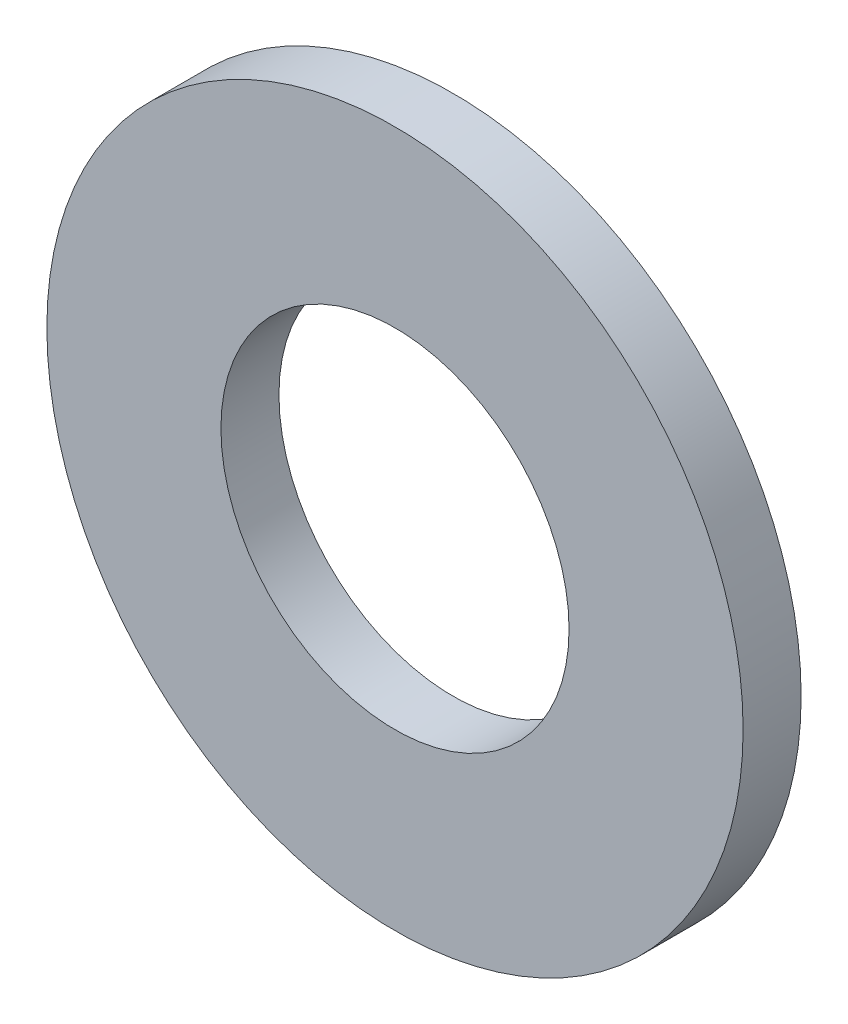
from build123d import *

# Parameters (mm, degrees)
SKETCH1_R      = 9.525
SKETCH1_R_2    = 4.7625
EXTRUDE1_DEPTH = 0.79375


with BuildPart() as part:
    # Sketch1 → Extrude1 (new, symmetric)
    with BuildSketch(Plane.XY):
        Circle(SKETCH1_R)
        Circle(SKETCH1_R_2, mode=Mode.SUBTRACT)
    extrude(amount=EXTRUDE1_DEPTH, both=True)


solid = part.part
